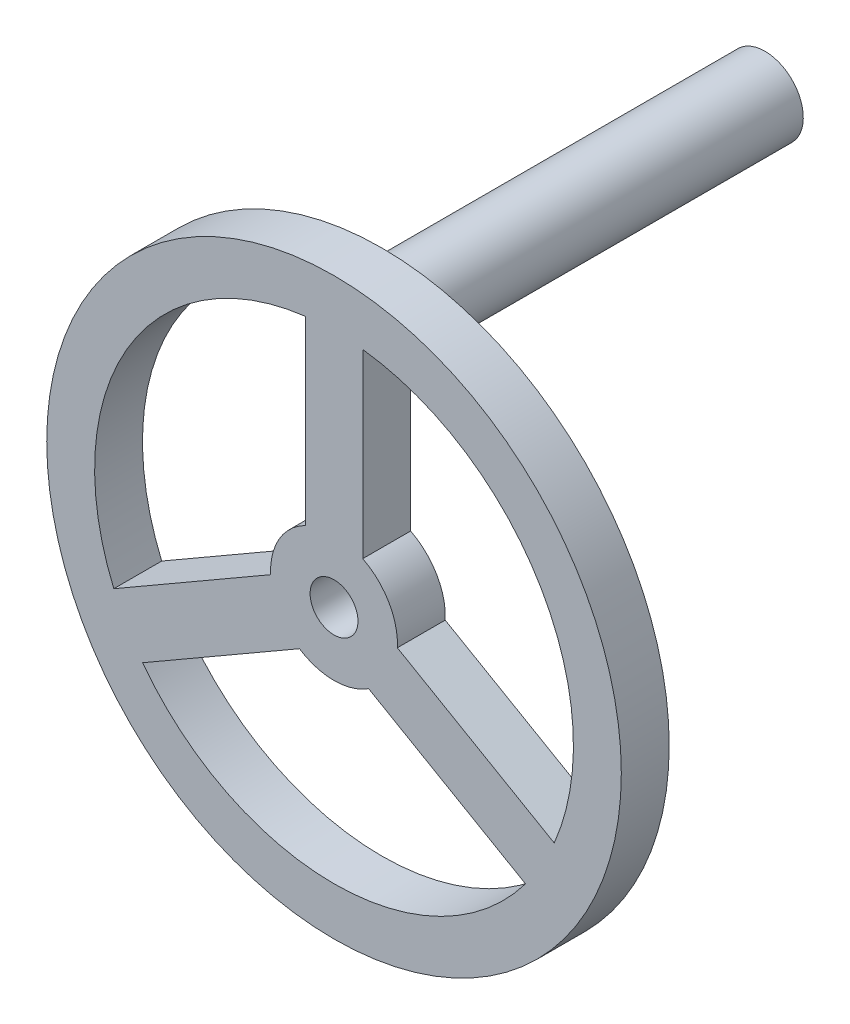
from build123d import *

# Parameters (mm, degrees)
SKETCH1_R           = 76.2
SKETCH1_R_2         = 63.5
SKETCH1_R_3         = 16.816105372
SKETCH1_R_4         = 6.35
BOSS_EXTRUDE1_DEPTH = 12.7
SKETCH2_R           = 10.16
BOSS_EXTRUDE2_DEPTH = 101.6


with BuildPart() as part:
    # Sketch1 → Boss-Extrude1 (new body)
    # profile 1 of 6: a face of its own
    with BuildSketch(Plane.XY):
        Circle(SKETCH1_R)
        Circle(SKETCH1_R_2, mode=Mode.SUBTRACT)
    # profile 2 of 6: a face of its own
    with BuildSketch(Plane.XY):
        with BuildLine():
            ThreePointArc((-7.62, 14.990563695), (-3.917811966, 16.353352845), (0, 16.816105372))
            Line((0, 16.816105372), (0, 63.5))
            ThreePointArc((0, 63.5), (-3.816901576, 63.385181725), (-7.62, 63.041142122))
            Line((-7.62, 63.041142122), (-7.62, 14.990563695))
        make_face()
    # profile 3 of 6: a face of its own
    with BuildSketch(Plane.XY):
        with BuildLine():
            Line((0, 63.5), (0, 16.816105372))
            ThreePointArc((0, 16.816105372), (3.917811966, 16.353352845), (7.62, 14.990563695))
            Line((7.62, 14.990563695), (7.62, 63.041142122))
            ThreePointArc((7.62, 63.041142122), (3.816901576, 63.385181725), (0, 63.5))
        make_face()
    # profile 4 of 6: a face of its own
    with BuildSketch(Plane.XY):
        with BuildLine():
            ThreePointArc((-9.172208976, -14.094395424), (-14.563174445, -8.408052686), (-16.792208976, -0.89616827))
            Line((-16.792208976, -0.89616827), (-58.405230561, -24.921457484))
            ThreePointArc((-58.405230561, -24.921457484), (-54.99261314, -31.75), (-50.785230561, -38.119684638))
            Line((-50.785230561, -38.119684638), (-9.172208976, -14.094395424))
        make_face()
    # profile 5 of 6: a face of its own
    with BuildSketch(Plane.XY):
        with BuildLine():
            Line((58.405230561, -24.921457484), (16.792208976, -0.89616827))
            ThreePointArc((16.792208976, -0.89616827), (14.563174445, -8.408052686), (9.172208976, -14.094395424))
            Line((9.172208976, -14.094395424), (50.785230561, -38.119684638))
            ThreePointArc((50.785230561, -38.119684638), (54.99261314, -31.75), (58.405230561, -24.921457484))
        make_face()
    # profile 6 of 6: a face of its own
    with BuildSketch(Plane.XY):
        Circle(SKETCH1_R_3)
        Circle(SKETCH1_R_4, mode=Mode.SUBTRACT)
    extrude(amount=BOSS_EXTRUDE1_DEPTH)

    # Sketch2 → Boss-Extrude2 (add)
    with BuildSketch(Plane(origin=(0, 0, 0), x_dir=(-1, 0, 0), z_dir=(0, 0, -1))):
        with Locations(Location((0, 60.427828817, 0), (0, 0, 166.938408153))):
            Circle(SKETCH2_R)
    extrude(amount=BOSS_EXTRUDE2_DEPTH)


solid = part.part
